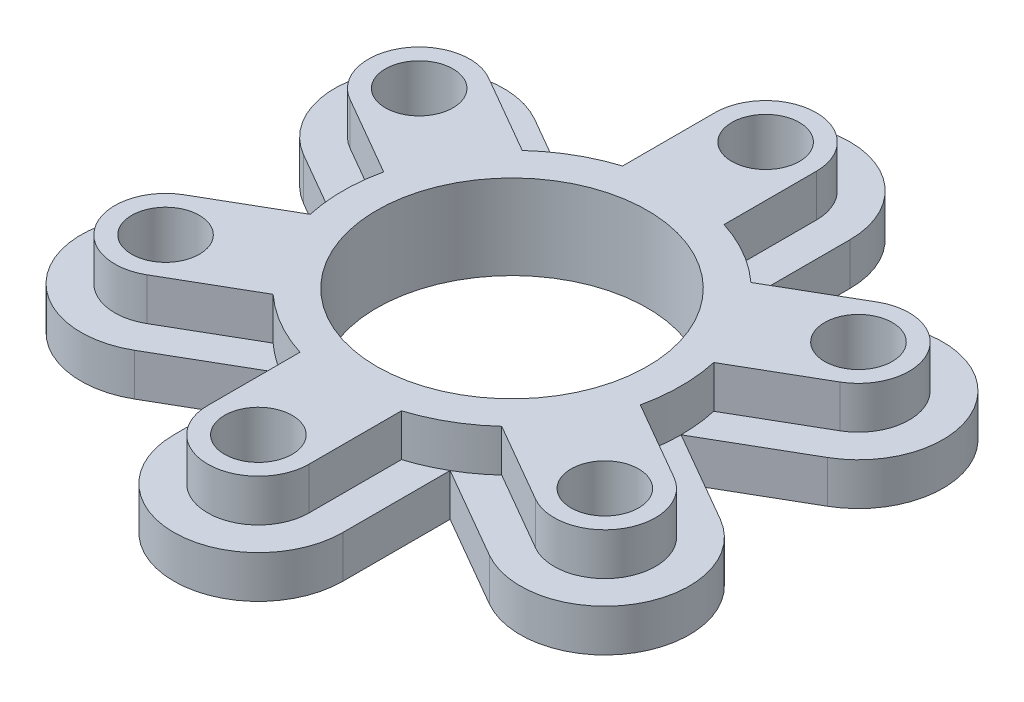
from build123d import *

# Parameters (mm, degrees)
SKETCH1_R           = 4
SKETCH1_R_2         = 16
BOSS_EXTRUDE1_DEPTH = 10
BOSS_EXTRUDE2_DEPTH = 5


with BuildPart() as part:
    # Sketch1 → Boss-Extrude1 (new body)
    with BuildSketch(Plane(origin=(0, 0, 0), x_dir=(1, 0, 0), z_dir=(0, 1, 0))):
        with BuildLine():
            ThreePointArc((-6, -30), (0, -36), (6, -30))
            Line((6, -30), (6, -19.078784028))
            ThreePointArc((6, -19.078784028), (10, -17.320508076), (13.522711642, -14.735544437))
            Line((13.522711642, -14.735544437), (22.980762114, -20.196152423))
            ThreePointArc((22.980762114, -20.196152423), (31.176914536, -18), (28.980762114, -9.803847577))
            Line((28.980762114, -9.803847577), (19.522711642, -4.343239591))
            ThreePointArc((19.522711642, -4.343239591), (20, 0), (19.522711642, 4.343239591))
            Line((19.522711642, 4.343239591), (28.980762114, 9.803847577))
            ThreePointArc((28.980762114, 9.803847577), (31.176914536, 18), (22.980762114, 20.196152423))
            Line((22.980762114, 20.196152423), (13.522711642, 14.735544437))
            ThreePointArc((13.522711642, 14.735544437), (10, 17.320508076), (6, 19.078784028))
            Line((6, 19.078784028), (6, 30))
            ThreePointArc((6, 30), (0, 36), (-6, 30))
            Line((-6, 30), (-6, 19.078784028))
            ThreePointArc((-6, 19.078784028), (-10, 17.320508076), (-13.522711642, 14.735544437))
            Line((-13.522711642, 14.735544437), (-22.980762114, 20.196152423))
            ThreePointArc((-22.980762114, 20.196152423), (-31.176914536, 18), (-28.980762114, 9.803847577))
            Line((-28.980762114, 9.803847577), (-19.522711642, 4.343239591))
            ThreePointArc((-19.522711642, 4.343239591), (-20, 0), (-19.522711642, -4.343239591))
            Line((-19.522711642, -4.343239591), (-28.980762114, -9.803847577))
            ThreePointArc((-28.980762114, -9.803847577), (-31.176914536, -18), (-22.980762114, -20.196152423))
            Line((-22.980762114, -20.196152423), (-13.522711642, -14.735544437))
            ThreePointArc((-13.522711642, -14.735544437), (-10, -17.320508076), (-6, -19.078784028))
            Line((-6, -19.078784028), (-6, -30))
        make_face()
        with Locations((0, 30)):
            Circle(SKETCH1_R, mode=Mode.SUBTRACT)
        Circle(SKETCH1_R_2, mode=Mode.SUBTRACT)
        with Locations((0, -30)):
            Circle(SKETCH1_R, mode=Mode.SUBTRACT)
        with Locations((-25.980762114, -15)):
            Circle(SKETCH1_R, mode=Mode.SUBTRACT)
        with Locations((-25.980762114, 15)):
            Circle(SKETCH1_R, mode=Mode.SUBTRACT)
        with Locations((25.980762114, -15)):
            Circle(SKETCH1_R, mode=Mode.SUBTRACT)
        with Locations((25.980762114, 15)):
            Circle(SKETCH1_R, mode=Mode.SUBTRACT)
    extrude(amount=BOSS_EXTRUDE1_DEPTH)

    # Sketch1<5> → Boss-Extrude2 (add)
    with BuildSketch(Plane(origin=(0, 0, 0), x_dir=(1, 0, 0), z_dir=(0, 1, 0))):
        with BuildLine():
            ThreePointArc((10, 30), (0, 40), (-10, 30))
            Line((-10, 30), (-10, 17.320508076))
            ThreePointArc((-10, 17.320508076), (-8.048160261, 18.309208514), (-6, 19.078784028))
            Line((-6, 19.078784028), (-6, 30))
            ThreePointArc((-6, 30), (0, 36), (6, 30))
            Line((6, 30), (6, 19.078784028))
            ThreePointArc((6, 19.078784028), (8.048160261, 18.309208514), (10, 17.320508076))
            Line((10, 17.320508076), (10, 30))
        make_face()
        with BuildLine():
            ThreePointArc((-13.522711642, 14.735544437), (-11.832159566, 16.124515497), (-10, 17.320508076))
            Line((-10, 17.320508076), (-20.980762114, 23.660254038))
            ThreePointArc((-20.980762114, 23.660254038), (-34.641016151, 20), (-30.980762114, 6.339745962))
            Line((-30.980762114, 6.339745962), (-20, 0))
            ThreePointArc((-20, 0), (-19.880319827, 2.184693018), (-19.522711642, 4.343239591))
            Line((-19.522711642, 4.343239591), (-28.980762114, 9.803847577))
            ThreePointArc((-28.980762114, 9.803847577), (-31.176914536, 18), (-22.980762114, 20.196152423))
            Line((-22.980762114, 20.196152423), (-13.522711642, 14.735544437))
        make_face()
        with BuildLine():
            Line((20.980762114, 23.660254038), (10, 17.320508076))
            ThreePointArc((10, 17.320508076), (11.832159566, 16.124515497), (13.522711642, 14.735544437))
            Line((13.522711642, 14.735544437), (22.980762114, 20.196152423))
            ThreePointArc((22.980762114, 20.196152423), (31.176914536, 18), (28.980762114, 9.803847577))
            Line((28.980762114, 9.803847577), (19.522711642, 4.343239591))
            ThreePointArc((19.522711642, 4.343239591), (19.880319827, 2.184693018), (20, 0))
            Line((20, 0), (30.980762114, 6.339745962))
            ThreePointArc((30.980762114, 6.339745962), (34.641016151, 20), (20.980762114, 23.660254038))
        make_face()
        with BuildLine():
            ThreePointArc((-19.522711642, -4.343239591), (-19.880319827, -2.184693018), (-20, 0))
            Line((-20, 0), (-30.980762114, -6.339745962))
            ThreePointArc((-30.980762114, -6.339745962), (-34.641016151, -20), (-20.980762114, -23.660254038))
            Line((-20.980762114, -23.660254038), (-10, -17.320508076))
            ThreePointArc((-10, -17.320508076), (-11.832159566, -16.124515497), (-13.522711642, -14.735544437))
            Line((-13.522711642, -14.735544437), (-22.980762114, -20.196152423))
            ThreePointArc((-22.980762114, -20.196152423), (-31.176914536, -18), (-28.980762114, -9.803847577))
            Line((-28.980762114, -9.803847577), (-19.522711642, -4.343239591))
        make_face()
        with BuildLine():
            Line((30.980762114, -6.339745962), (20, 0))
            ThreePointArc((20, 0), (19.880319827, -2.184693018), (19.522711642, -4.343239591))
            Line((19.522711642, -4.343239591), (28.980762114, -9.803847577))
            ThreePointArc((28.980762114, -9.803847577), (31.176914536, -18), (22.980762114, -20.196152423))
            Line((22.980762114, -20.196152423), (13.522711642, -14.735544437))
            ThreePointArc((13.522711642, -14.735544437), (11.832159566, -16.124515497), (10, -17.320508076))
            Line((10, -17.320508076), (20.980762114, -23.660254038))
            ThreePointArc((20.980762114, -23.660254038), (34.641016151, -20), (30.980762114, -6.339745962))
        make_face()
        with BuildLine():
            ThreePointArc((-6, -19.078784028), (-8.048160261, -18.309208514), (-10, -17.320508076))
            Line((-10, -17.320508076), (-10, -30))
            ThreePointArc((-10, -30), (0, -40), (10, -30))
            Line((10, -30), (10, -17.320508076))
            ThreePointArc((10, -17.320508076), (8.048160261, -18.309208514), (6, -19.078784028))
            Line((6, -19.078784028), (6, -30))
            ThreePointArc((6, -30), (0, -36), (-6, -30))
            Line((-6, -30), (-6, -19.078784028))
        make_face()
    extrude(amount=BOSS_EXTRUDE2_DEPTH)


solid = part.part
